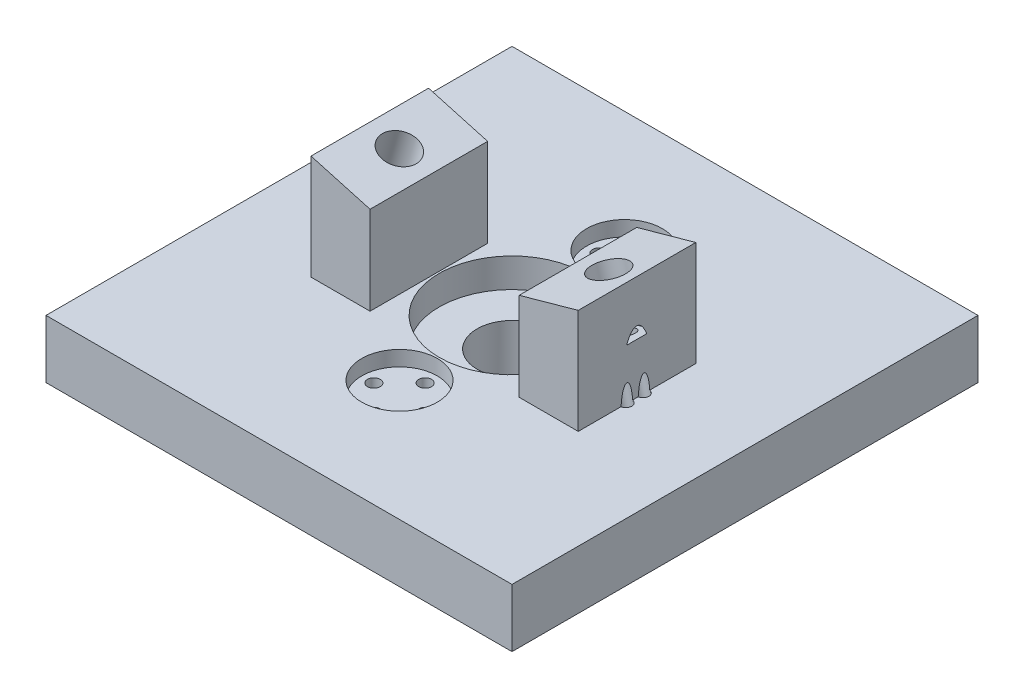
from build123d import *

# Parameters (mm, degrees)
SKETCH28_W                                   = 80
SKETCH28_H                                   = 80
BOSS_EXTRUDE1_DEPTH                          = 10
CBORE_FOR_M10_CHEESE_HEAD_SCREW1_D           = 12
CBORE_FOR_M10_CHEESE_HEAD_SCREW1_CBORE_D     = 25
CBORE_FOR_M10_CHEESE_HEAD_SCREW1_CBORE_DEPTH = 5
BOSS_EXTRUDE2_START                          = 5
SKETCH31_W                                   = 25
SKETCH31_H                                   = 24
SKETCH31_R                                   = 6
BOSS_EXTRUDE2_DEPTH                          = 5
SKETCH36_R                                   = 1
BOSS_EXTRUDE5_DEPTH                          = 5
SKETCH37_R                                   = 6.5
CUT_EXTRUDE1_DEPTH                           = 2.6
SKETCH38_R                                   = 1.1
CUT_EXTRUDE2_DEPTH                           = 64.398733217
SKETCH39_W                                   = 10.140014898
SKETCH39_H                                   = 20.185275771
SKETCH39_W_2                                 = 10.140014899
BOSS_EXTRUDE6_DEPTH                          = 18
CUT_EXTRUDE3_REACH                           = 73.95
SKETCH42_R                                   = 3
CUT_EXTRUDE4_DEPTH                           = 9
SKETCH43_R                                   = 1.011275837
CUT_EXTRUDE5_DEPTH                           = 67.446435697
CUT_EXTRUDE7_REACH                           = 72.05
SKETCH47_R                                   = 3
CUT_EXTRUDE8_DEPTH                           = 9
SKETCH48_R                                   = 1
CUT_EXTRUDE9_DEPTH                           = 65.394869849


with BuildPart() as part:
    # Sketch28 → Boss-Extrude1 (new body)
    with BuildSketch(Plane(origin=(0, 0, 0), x_dir=(1, 0, 0), z_dir=(0, 1, 0))):
        with Locations((1.944585414, 4.241283073)):
            Rectangle(SKETCH28_W, SKETCH28_H)
    extrude(amount=BOSS_EXTRUDE1_DEPTH)

    # CBORE for M10 Cheese Head Screw1 (through all)
    with Locations(Plane(origin=(0, 10, 0), x_dir=(1, 0, 0), z_dir=(0, 1, 0))):
        with Locations((1.944585414, 4.241283073)):
            CounterBoreHole(CBORE_FOR_M10_CHEESE_HEAD_SCREW1_D / 2, CBORE_FOR_M10_CHEESE_HEAD_SCREW1_CBORE_D / 2, CBORE_FOR_M10_CHEESE_HEAD_SCREW1_CBORE_DEPTH)

    # Sketch31 → Boss-Extrude2 (add)
    with BuildSketch(Plane(origin=(0, 0, 0), x_dir=(-1, 0, 0), z_dir=(0, -1, 0)).offset(BOSS_EXTRUDE2_START)):
        with Locations((-1.944585414, 6.741283073)):
            Rectangle(SKETCH31_W, SKETCH31_H)
        with Locations(Location((-1.944585414, 4.241283073, 0), (0, 0, 270))):
            Circle(SKETCH31_R, mode=Mode.SUBTRACT)
    extrude(amount=-BOSS_EXTRUDE2_DEPTH)

    # Sketch36 → Boss-Extrude5 (add)
    with BuildSketch(Plane.XZ.offset(5)):
        with Locations(Location((12.444585414, -16.741283073, 0), (0, 0, 90))):
            Circle(SKETCH36_R)
        with Locations(Location((12.444585414, -4.241283073, 0), (0, 0, 90))):
            Circle(SKETCH36_R)
        with Locations(Location((-8.555414586, -16.741283073, 0), (0, 0, 90))):
            Circle(SKETCH36_R)
        with Locations(Location((-8.555414586, -4.241283073, 0), (0, 0, 90))):
            Circle(SKETCH36_R)
    extrude(amount=BOSS_EXTRUDE5_DEPTH)

    # Sketch37 → Cut-Extrude1 (cut)
    with BuildSketch(Plane(origin=(0, 10, 0), x_dir=(1, 0, 0), z_dir=(0, 1, 0))):
        with Locations(Location((1.944585414, -15.067812269, 0), (0, 0, 270))):
            Circle(SKETCH37_R)
        with Locations(Location((1.944585414, 23.550378415, 0), (0, 0, 90))):
            Circle(SKETCH37_R)
    extrude(amount=-CUT_EXTRUDE1_DEPTH, mode=Mode.SUBTRACT)

    # Sketch38 → Cut-Extrude2 (cut, through all)
    with BuildSketch(Plane(origin=(0, 7.4, 0), x_dir=(1, 0, 0), z_dir=(0, 1, 0))):
        with Locations(Location((1.944585414, -19.467812269, 0), (0, 0, 270))):
            Circle(SKETCH38_R)
        with Locations(Location((-2.455414586, -15.067812269, 0), (0, 0, 270))):
            Circle(SKETCH38_R)
        with Locations(Location((1.944585414, -10.667812269, 0), (0, 0, 270))):
            Circle(SKETCH38_R)
        with Locations(Location((6.344585414, -15.067812269, 0), (0, 0, 270))):
            Circle(SKETCH38_R)
        with Locations(Location((1.944585414, 27.950378415, 0), (0, 0, 90))):
            Circle(SKETCH38_R)
        with Locations(Location((6.344585414, 23.550378415, 0), (0, 0, 90))):
            Circle(SKETCH38_R)
        with Locations(Location((1.944585414, 19.150378415, 0), (0, 0, 338.166857226))):
            Circle(SKETCH38_R)
        with Locations(Location((-2.455414586, 23.550378415, 0), (0, 0, 90))):
            Circle(SKETCH38_R)
    extrude(amount=-CUT_EXTRUDE2_DEPTH, mode=Mode.SUBTRACT)

    # Sketch39 → Boss-Extrude6 (add)
    with BuildSketch(Plane(origin=(-3.101061249, 10, 0), x_dir=(1, 0, 0), z_dir=(0, 1, 0))):
        with Locations((22.915466142, 2.76667369)):
            Rectangle(SKETCH39_W, SKETCH39_H)
        with Locations((-12.824172815, 2.76667369)):
            Rectangle(SKETCH39_W_2, SKETCH39_H)
    extrude(amount=BOSS_EXTRUDE6_DEPTH)

    # Sketch41 → Cut-Extrude3 (cut, up to next)
    with BuildSketch(Plane(origin=(-3.101061249, 0, -12.859311575), x_dir=(-1, 0, 0), z_dir=(0, 0, -1)), mode=Mode.PRIVATE) as cut_extrude3_sk1:
        Polygon((-17.845458693, 28), (-27.985473591, 28), (-17.845458693, 25.166138953), align=None)
    cut_extrude3_tool1 = extrude(cut_extrude3_sk1.sketch, amount=-CUT_EXTRUDE3_REACH, mode=Mode.PRIVATE) & part.part
    add(cut_extrude3_tool1.solids().sort_by_distance((18.124402, 27.05538, -12.859312))[0], mode=Mode.SUBTRACT)

    # Sketch42 → Cut-Extrude4 (cut)
    with BuildSketch(Plane(origin=(-8.331937614, 18.716924855, 0), x_dir=(0.9630956709984104, 0.2691592994940385, 0), z_dir=(-0.26915929949403855, 0.9630956709984105, 0))):
        with Locations(Location((29.519399999, 2.697534427, 0), (0, 0, 180))):
            Circle(SKETCH42_R)
    extrude(amount=-CUT_EXTRUDE4_DEPTH, mode=Mode.SUBTRACT)

    # Sketch43 → Cut-Extrude5 (cut, through all)
    with BuildSketch(Plane(origin=(-3.033104412, 10.852940003, 0), x_dir=(0.9630956709984104, 0.26915929949403844, 0), z_dir=(-0.2691592994940385, 0.9630956709984105, 0))):
        with Locations(Location((26.468109022, 1.00975317, 0), (0, 0, 180))):
            Circle(SKETCH43_R)
        with Locations(Location((26.468109022, 3.95432313, 0), (0, 0, 180))):
            Circle(SKETCH43_R)
    extrude(amount=-CUT_EXTRUDE5_DEPTH, mode=Mode.SUBTRACT)

    # Sketch46 → Cut-Extrude7 (cut, up to next)
    with BuildSketch(Plane(origin=(0, 0, -12.859311575), x_dir=(-1, 0, 0), z_dir=(0, 0, -1)), mode=Mode.PRIVATE) as cut_extrude7_sk1:
        Polygon((10.855226615, 25.166138953), (20.995241513, 28), (10.855226615, 28), align=None)
    cut_extrude7_tool1 = extrude(cut_extrude7_sk1.sketch, amount=-CUT_EXTRUDE7_REACH, mode=Mode.PRIVATE) & part.part
    add(cut_extrude7_tool1.solids().sort_by_distance((-14.235232, 27.05538, -12.859312))[0], mode=Mode.SUBTRACT)

    # Sketch47 → Cut-Extrude8 (cut)
    with BuildSketch(Plane(origin=(5.737295811, 20.528975847, 0), x_dir=(0.9630956709983024, -0.26915929949442535, 0), z_dir=(0.2691592994944253, 0.9630956709983023, 0))):
        with Locations(Location((-22.492604345, 2.766673689, 0), (0, 0, 180))):
            Circle(SKETCH47_R)
    extrude(amount=-CUT_EXTRUDE8_DEPTH, mode=Mode.SUBTRACT)

    # Sketch48 → Cut-Extrude9 (cut, through all)
    with BuildSketch(Plane(origin=(3.314862115, 11.861114808, 0), x_dir=(0.9630956709983024, -0.26915929949442546, 0), z_dir=(0.2691592994944254, 0.9630956709983023, 0))):
        with Locations(Location((-22.718123544, 4.075619229, 0), (0, 0, 180))):
            Circle(SKETCH48_R)
        with Locations(Location((-22.718123544, 1.383948503, 0), (0, 0, 180))):
            Circle(SKETCH48_R)
    extrude(amount=-CUT_EXTRUDE9_DEPTH, mode=Mode.SUBTRACT)


solid = part.part
